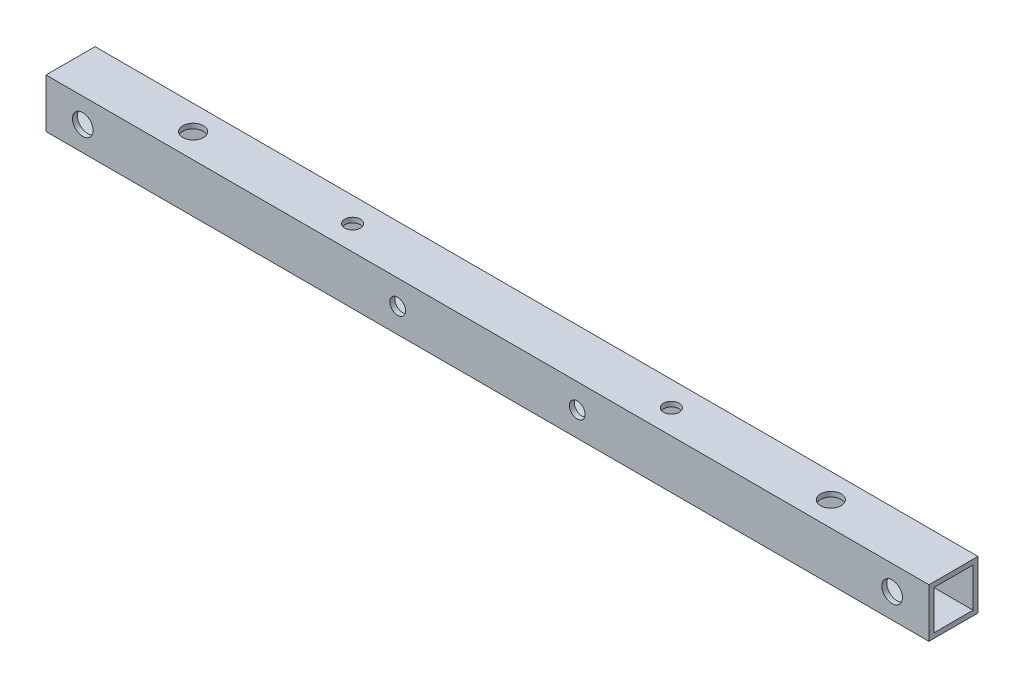
from build123d import *

# Parameters (mm, degrees)
SKETCH_1_W          = 10
SKETCH_1_H          = 10
SKETCH_1_W_2        = 8
SKETCH_1_H_2        = 8
EXTRUDE_1_DEPTH     = 180
SKETCH_2_R          = 2.1
CUT_EXTRUDE_1_DEPTH = 181.346887969
SKETCH_3_R          = 2.1
CUT_EXTRUDE_2_DEPTH = 181.346887969
SKETCH_4_R          = 1.6
CUT_EXTRUDE_3_DEPTH = 181.346887969
SKETCH_5_R          = 1.6
CUT_EXTRUDE_4_DEPTH = 181.346887969


with BuildPart() as part:
    # ｽｹｯﾁ1 → 押し出し-薄板1 (new body)
    with BuildSketch(Plane(origin=(0, 0, 0), x_dir=(0, 0, -1), z_dir=(1, 0, 0))):
        Rectangle(SKETCH_1_W, SKETCH_1_H)
        Rectangle(SKETCH_1_W_2, SKETCH_1_H_2, mode=Mode.SUBTRACT)
    extrude(amount=EXTRUDE_1_DEPTH)

    # ｽｹｯﾁ2 → ｶｯﾄ - 押し出し1 (cut, through all)
    with BuildSketch(Plane.XY.offset(5)):
        with Locations((7.5, 0)):
            Circle(SKETCH_2_R)
        with Locations(Location((172.5, 0, 0), (0, 0, 90))):
            Circle(SKETCH_2_R)
    extrude(amount=-CUT_EXTRUDE_1_DEPTH, mode=Mode.SUBTRACT)

    # ｽｹｯﾁ3 → ｶｯﾄ - 押し出し2 (cut, through all)
    with BuildSketch(Plane(origin=(0, 5, 0), x_dir=(1, 0, 0), z_dir=(0, 1, 0))):
        with Locations(Location((25, 0, 0), (0, 0, 270))):
            Circle(SKETCH_3_R)
        with Locations(Location((155, 0, 0), (0, 0, 270))):
            Circle(SKETCH_3_R)
    extrude(amount=-CUT_EXTRUDE_2_DEPTH, mode=Mode.SUBTRACT)

    # ｽｹｯﾁ4 → ｶｯﾄ - 押し出し3 (cut, through all)
    with BuildSketch(Plane.XY.offset(5)):
        with Locations((71.7, 0)):
            Circle(SKETCH_4_R)
        with Locations(Location((108.3, 0, 0), (0, 0, 90))):
            Circle(SKETCH_4_R)
    extrude(amount=-CUT_EXTRUDE_3_DEPTH, mode=Mode.SUBTRACT)

    # ｽｹｯﾁ5 → ｶｯﾄ - 押し出し4 (cut, through all)
    with BuildSketch(Plane(origin=(0, 5, 0), x_dir=(1, 0, 0), z_dir=(0, 1, 0))):
        with Locations(Location((57.5, 0, 0), (0, 0, 270))):
            Circle(SKETCH_5_R)
        with Locations(Location((122.5, 0, 0), (0, 0, 270))):
            Circle(SKETCH_5_R)
    extrude(amount=-CUT_EXTRUDE_4_DEPTH, mode=Mode.SUBTRACT)


solid = part.part
